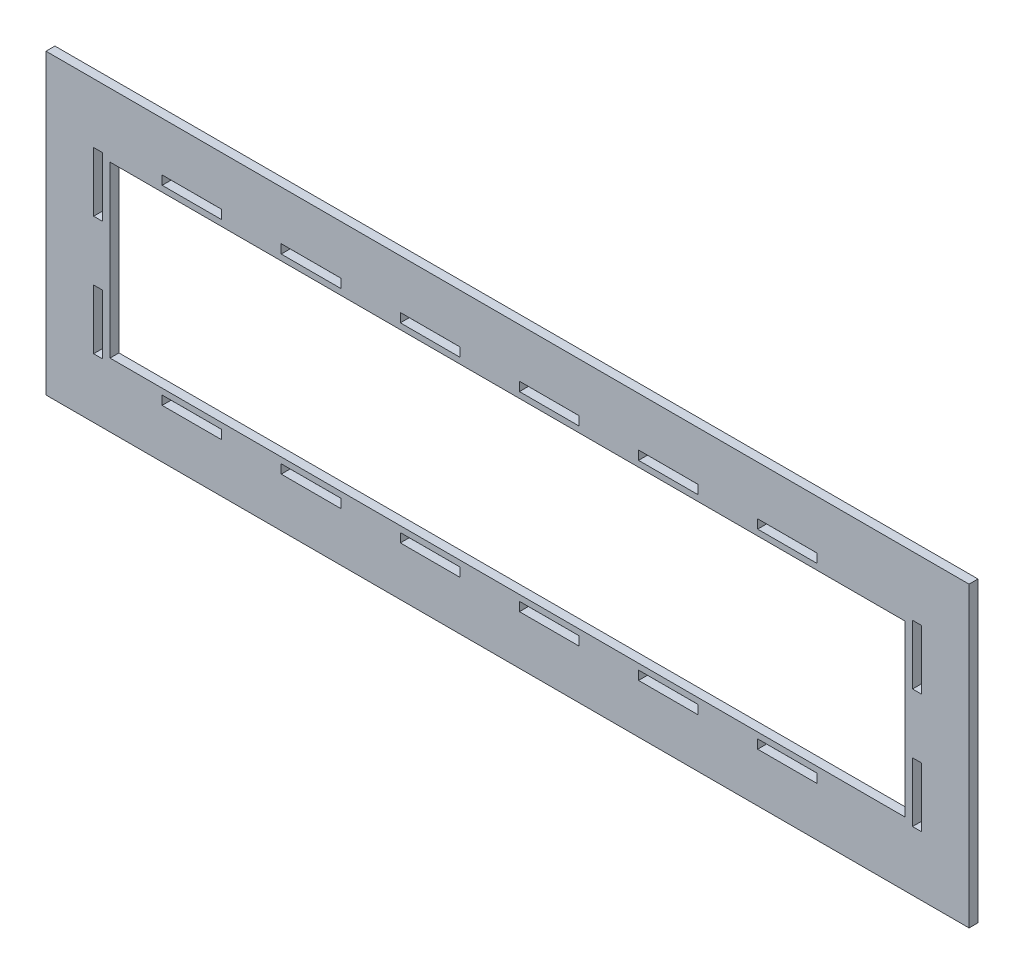
from build123d import *

# Parameters (mm, degrees)
CROQUIS1_W                = 620
CROQUIS1_H                = 200
CROQUIS1_W_2              = 534
CROQUIS1_H_2              = 114
SALIENTE_EXTRUIR1_DEPTH   = 6
CROQUIS2_W                = 6.02
CROQUIS2_H                = 40
CORTAR_EXTRUIR1_DEPTH     = 6
CROQUIS3_W                = 40
CROQUIS3_H                = 6.02
CORTAR_EXTRUIR2_DEPTH     = 6
MATRIZL1_COUNT            = 6
MATRIZL1_PITCH            = 80
SIMETR_A1_COPY_1_SKETCH_W = 40
SIMETR_A1_COPY_1_SKETCH_H = 6.02
SIMETR_A1_COPY_1_DEPTH    = 6
SIMETR_A1_COPY_2_SKETCH_W = 40
SIMETR_A1_COPY_2_SKETCH_H = 6.02
SIMETR_A1_COPY_2_DEPTH    = 6
SIMETR_A1_COPY_3_SKETCH_W = 40
SIMETR_A1_COPY_3_SKETCH_H = 6.02
SIMETR_A1_COPY_3_DEPTH    = 6
SIMETR_A1_COPY_4_SKETCH_W = 40
SIMETR_A1_COPY_4_SKETCH_H = 6.02
SIMETR_A1_COPY_4_DEPTH    = 6
SIMETR_A1_COPY_5_SKETCH_W = 40
SIMETR_A1_COPY_5_SKETCH_H = 6.02
SIMETR_A1_COPY_5_DEPTH    = 6


with BuildPart() as part:
    # Croquis1 → Saliente-Extruir1 (new body)
    with BuildSketch(Plane.XY):
        Rectangle(CROQUIS1_W, CROQUIS1_H)
        Rectangle(CROQUIS1_W_2, CROQUIS1_H_2, mode=Mode.SUBTRACT)
    extrude(amount=SALIENTE_EXTRUIR1_DEPTH)

    # Croquis2 → Cortar-Extruir1 (cut)
    with BuildSketch(Plane.XY.offset(6)):
        with Locations((-275.01, 40)):
            Rectangle(CROQUIS2_W, CROQUIS2_H)
        with Locations((-275.01, -40)):
            Rectangle(CROQUIS2_W, CROQUIS2_H)
        with Locations((275.01, -40)):
            Rectangle(CROQUIS2_W, CROQUIS2_H)
        with Locations((275.01, 40)):
            Rectangle(CROQUIS2_W, CROQUIS2_H)
    extrude(amount=-CORTAR_EXTRUIR1_DEPTH, mode=Mode.SUBTRACT)

    # Croquis3 → Cortar-Extruir2 (cut)
    with BuildSketch(Plane.XY.offset(6)):
        with Locations((-212, 64.01)):
            Rectangle(CROQUIS3_W, CROQUIS3_H)
    cortar_extruir2 = extrude(amount=-CORTAR_EXTRUIR2_DEPTH, mode=Mode.SUBTRACT)

    # MatrizL1: Cortar-Extruir2 ×6
    with Locations(*[(i * MATRIZL1_PITCH, 0, 0) for i in range(1, MATRIZL1_COUNT)]):
        add(cortar_extruir2, mode=Mode.SUBTRACT)

    # Simetría1: Cortar-Extruir2 across plane
    add(cortar_extruir2.mirror(Plane.ZX), mode=Mode.SUBTRACT)

    # Simetría1 copy 1 sketch → Simetría1 copy 1 (cut)
    with BuildSketch(Plane(origin=(80, 0, 6), x_dir=(1, 0, 0), z_dir=(0, 0, 1))):
        with Locations((-212, -64.01)):
            Rectangle(SIMETR_A1_COPY_1_SKETCH_W, SIMETR_A1_COPY_1_SKETCH_H)
    extrude(amount=-SIMETR_A1_COPY_1_DEPTH, mode=Mode.SUBTRACT)

    # Simetría1 copy 2 sketch → Simetría1 copy 2 (cut)
    with BuildSketch(Plane(origin=(160, 0, 6), x_dir=(1, 0, 0), z_dir=(0, 0, 1))):
        with Locations((-212, -64.01)):
            Rectangle(SIMETR_A1_COPY_2_SKETCH_W, SIMETR_A1_COPY_2_SKETCH_H)
    extrude(amount=-SIMETR_A1_COPY_2_DEPTH, mode=Mode.SUBTRACT)

    # Simetría1 copy 3 sketch → Simetría1 copy 3 (cut)
    with BuildSketch(Plane(origin=(240, 0, 6), x_dir=(1, 0, 0), z_dir=(0, 0, 1))):
        with Locations((-212, -64.01)):
            Rectangle(SIMETR_A1_COPY_3_SKETCH_W, SIMETR_A1_COPY_3_SKETCH_H)
    extrude(amount=-SIMETR_A1_COPY_3_DEPTH, mode=Mode.SUBTRACT)

    # Simetría1 copy 4 sketch → Simetría1 copy 4 (cut)
    with BuildSketch(Plane(origin=(320, 0, 6), x_dir=(1, 0, 0), z_dir=(0, 0, 1))):
        with Locations((-212, -64.01)):
            Rectangle(SIMETR_A1_COPY_4_SKETCH_W, SIMETR_A1_COPY_4_SKETCH_H)
    extrude(amount=-SIMETR_A1_COPY_4_DEPTH, mode=Mode.SUBTRACT)

    # Simetría1 copy 5 sketch → Simetría1 copy 5 (cut)
    with BuildSketch(Plane(origin=(400, 0, 6), x_dir=(1, 0, 0), z_dir=(0, 0, 1))):
        with Locations((-212, -64.01)):
            Rectangle(SIMETR_A1_COPY_5_SKETCH_W, SIMETR_A1_COPY_5_SKETCH_H)
    extrude(amount=-SIMETR_A1_COPY_5_DEPTH, mode=Mode.SUBTRACT)


solid = part.part
